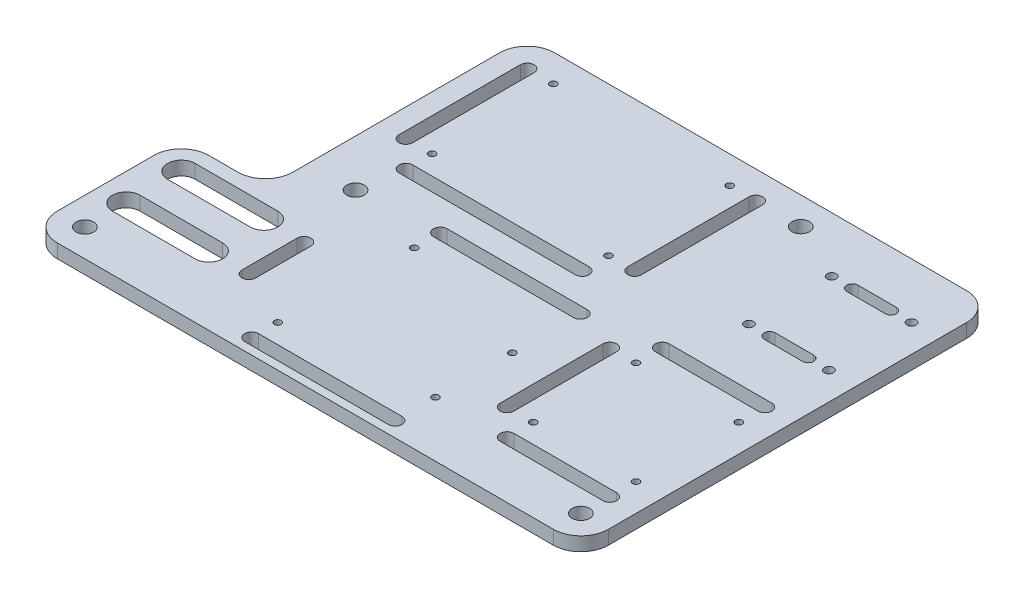
from build123d import *

# Parameters (mm, degrees)
BOSS_EXTRUDE1_DEPTH          = 5
ARDUINO_UNO_HOLES_D          = 2.5
L298N_HOLES_D                = 2.5
PROTOBOARD_HOLES_D           = 2.5
L_BRACKET_HOLES_D            = 3.3
POWER_BLOCK_SLOTS_DEPTH      = 126.099960032
CABLE_MANAGEMENT_SLOTS_DEPTH = 126.099960032
CUT_EXTRUDE3_START           = -10
CUT_EXTRUDE3_DEPTH           = 10
WALL_MOUNTING_HOLES_D        = 6.35


with BuildPart() as part:
    # Sketch1 → Boss-Extrude1 (new body)
    with BuildSketch(Plane(origin=(0, 0, 0), x_dir=(1, 0, 0), z_dir=(0, 1, 0))):
        with BuildLine():
            Line((-90, -75), (90, -75))
            ThreePointArc((90, -75), (97.071067812, -72.071067812), (100, -65))
            Line((100, -65), (100, 65))
            ThreePointArc((100, 65), (97.071067812, 72.071067812), (90, 75))
            Line((90, 75), (-90, 75))
            ThreePointArc((-90, 75), (-97.071067812, 72.071067812), (-100, 65))
            Line((-100, 65), (-100, -65))
            ThreePointArc((-100, -65), (-97.071067812, -72.071067812), (-90, -75))
        make_face()
    extrude(amount=BOSS_EXTRUDE1_DEPTH)

    # arduino uno holes (through all)
    with Locations(Plane(origin=(0, 5, 0), x_dir=(1, 0, 0), z_dir=(0, 1, 0))):
        with Locations((27.1, -27), (27.1, -54.9), (-23.7, -11.8), (-25, -60)):
            Hole(ARDUINO_UNO_HOLES_D / 2)

    # l298n holes (through all)
    with Locations(Plane(origin=(0, 5, 0), x_dir=(1, 0, 0), z_dir=(0, 1, 0))):
        with Locations((52.7, -45), (90, -45), (90, -7.7), (52.7, -7.7)):
            Hole(L298N_HOLES_D / 2)

    # protoboard holes (through all)
    with Locations(Plane(origin=(0, 5, 0), x_dir=(1, 0, 0), z_dir=(0, 1, 0))):
        with Locations((-50, 21), (14, 21), (14, 65), (-50, 65)):
            Hole(PROTOBOARD_HOLES_D / 2)

    # l-bracket holes (through all)
    with Locations(Plane(origin=(0, 5, 0), x_dir=(1, 0, 0), z_dir=(0, 1, 0))):
        with Locations((61, 55), (90, 55), (90, 25), (61, 25)):
            Hole(L_BRACKET_HOLES_D / 2)

    # Sketch24 → power block slots (cut, through all)
    with BuildSketch(Plane(origin=(0, 5, 0), x_dir=(1, 0, 0), z_dir=(0, 1, 0))):
        with BuildLine():
            Line((-60, -35), (-90, -35))
            ThreePointArc((-90, -35), (-95, -30), (-90, -25))
            Line((-90, -25), (-60, -25))
            ThreePointArc((-60, -25), (-55, -30), (-60, -35))
        make_face()
        with BuildLine():
            Line((-60, -45), (-90, -45))
            ThreePointArc((-90, -45), (-95, -50), (-90, -55))
            Line((-90, -55), (-60, -55))
            ThreePointArc((-60, -55), (-55, -50), (-60, -45))
        make_face()
    extrude(amount=-POWER_BLOCK_SLOTS_DEPTH, mode=Mode.SUBTRACT)

    # Sketch26 → cable management slots (cut, through all)
    with BuildSketch(Plane(origin=(0, 5, 0), x_dir=(1, 0, 0), z_dir=(0, 1, 0))):
        with BuildLine():
            Line((-50, 14), (14, 14))
            ThreePointArc((14, 14), (16.5, 11.5), (14, 9))
            Line((14, 9), (-50, 9))
            ThreePointArc((-50, 9), (-52.5, 11.5), (-50, 14))
        make_face()
        with BuildLine():
            Line((26, 65), (26, 21))
            ThreePointArc((26, 21), (23.5, 18.5), (21, 21))
            Line((21, 21), (21, 65))
            ThreePointArc((21, 65), (23.5, 67.5), (26, 65))
        make_face()
        with BuildLine():
            Line((68.5, 57), (82.5, 57))
            ThreePointArc((82.5, 57), (84.5, 55), (82.5, 53))
            Line((82.5, 53), (68.5, 53))
            ThreePointArc((68.5, 53), (66.5, 55), (68.5, 57))
        make_face()
        with BuildLine():
            Line((68.5, 27), (82.5, 27))
            ThreePointArc((82.5, 27), (84.5, 25), (82.5, 23))
            Line((82.5, 23), (68.5, 23))
            ThreePointArc((68.5, 23), (66.5, 25), (68.5, 27))
        make_face()
        with BuildLine():
            Line((52.7, 4.3), (90, 4.3))
            ThreePointArc((90, 4.3), (92.5, 1.8), (90, -0.7))
            Line((90, -0.7), (52.7, -0.7))
            ThreePointArc((52.7, -0.7), (50.2, 1.8), (52.7, 4.3))
        make_face()
        with BuildLine():
            Line((45.7, -7.7), (45.7, -45))
            ThreePointArc((45.7, -45), (43.2, -47.5), (40.7, -45))
            Line((40.7, -45), (40.7, -7.7))
            ThreePointArc((40.7, -7.7), (43.2, -5.2), (45.7, -7.7))
        make_face()
        with BuildLine():
            Line((-25, -67), (27.1, -67))
            ThreePointArc((27.1, -67), (29.6, -69.5), (27.1, -72))
            Line((27.1, -72), (-25, -72))
            ThreePointArc((-25, -72), (-27.5, -69.5), (-25, -67))
        make_face()
        with BuildLine():
            Line((-43, -30), (-43, -50))
            ThreePointArc((-43, -50), (-45.5, -52.5), (-48, -50))
            Line((-48, -50), (-48, -30))
            ThreePointArc((-48, -30), (-45.5, -27.5), (-43, -30))
        make_face()
        with BuildLine():
            Line((-23.7, 0.2), (27.1, 0.2))
            ThreePointArc((27.1, 0.2), (29.6, -2.3), (27.1, -4.8))
            Line((27.1, -4.8), (-23.7, -4.8))
            ThreePointArc((-23.7, -4.8), (-26.2, -2.3), (-23.7, 0.2))
        make_face()
        with BuildLine():
            Line((-57, 65), (-57, 21))
            ThreePointArc((-57, 21), (-59.5, 18.5), (-62, 21))
            Line((-62, 21), (-62, 65))
            ThreePointArc((-62, 65), (-59.5, 67.5), (-57, 65))
        make_face()
        with BuildLine():
            Line((90, -57), (52.7, -57))
            ThreePointArc((52.7, -57), (50.2, -54.5), (52.7, -52))
            Line((52.7, -52), (90, -52))
            ThreePointArc((90, -52), (92.5, -54.5), (90, -57))
        make_face()
    extrude(amount=-CABLE_MANAGEMENT_SLOTS_DEPTH, mode=Mode.SUBTRACT)

    # Sketch27 → Cut-Extrude3 (cut)
    with BuildSketch(Plane(origin=(0, 5, 0), x_dir=(1, 0, 0), z_dir=(0, 1, 0)).offset(CUT_EXTRUDE3_START)):
        with BuildLine():
            Line((-69.5, -10), (-69.5, 65))
            ThreePointArc((-69.5, 65), (-66.571067812, 72.071067812), (-59.5, 75))
            Line((-59.5, 75), (-90, 75))
            ThreePointArc((-90, 75), (-97.071067812, 72.071067812), (-100, 65))
            Line((-100, 65), (-100, -30))
            ThreePointArc((-100, -30), (-97.071067812, -22.928932188), (-90, -20))
            Line((-90, -20), (-79.5, -20))
            ThreePointArc((-79.5, -20), (-72.428932188, -17.071067812), (-69.5, -10))
        make_face()
    extrude(amount=CUT_EXTRUDE3_DEPTH, mode=Mode.SUBTRACT)

    # wall-mounting holes (through all)
    with Locations(Plane(origin=(0, 5, 0), x_dir=(1, 0, 0), z_dir=(0, 1, 0))):
        with Locations((-90, -65), (90, -65), (39.784709297, 65), (-52.5, -4.3)):
            Hole(WALL_MOUNTING_HOLES_D / 2)


solid = part.part
